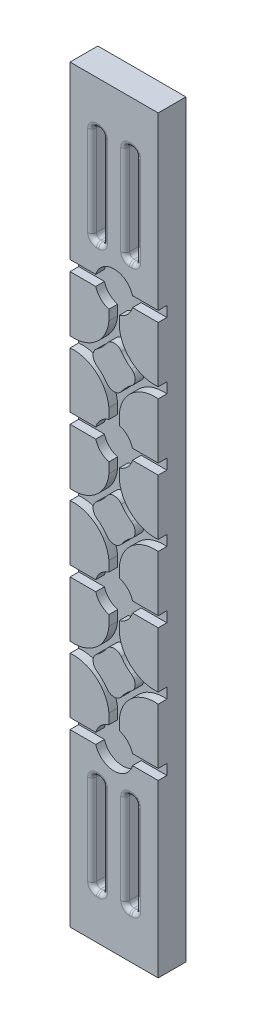
from build123d import *

# Parameters (mm, degrees)
SKETCH1_W           = 25.4
SKETCH1_H           = 215.9
SKETCH1_W_2         = 3.175
SKETCH1_H_2         = 28.575
BOSS_EXTRUDE1_DEPTH = 8
FILLET1_R           = 1.27
CUT_EXTRUDE1_DEPTH  = 2.5
FILLET2_R           = 2.54


with BuildPart() as part:
    # Sketch1 → Boss-Extrude1 (new body)
    with BuildSketch(Plane.XY):
        with Locations((12.7, 107.95)):
            Rectangle(SKETCH1_W, SKETCH1_H)
        with Locations((7.9375, 188.9125)):
            Rectangle(SKETCH1_W_2, SKETCH1_H_2, mode=Mode.SUBTRACT)
        with Locations((17.4625, 188.9125)):
            Rectangle(SKETCH1_W_2, SKETCH1_H_2, mode=Mode.SUBTRACT)
        with Locations((7.9375, 26.9875)):
            Rectangle(SKETCH1_W_2, SKETCH1_H_2, mode=Mode.SUBTRACT)
        with Locations((17.4625, 26.9875)):
            Rectangle(SKETCH1_W_2, SKETCH1_H_2, mode=Mode.SUBTRACT)
    extrude(amount=BOSS_EXTRUDE1_DEPTH)

    # Fillet1
    fillet1_edges = [part.edges().sort_by_distance(p)[0] for p in [
        (6.35, 188.9125, 0),
        (6.35, 203.2, 4),
        (7.9375, 174.625, 0),
        (6.35, 174.625, 4),
        (9.525, 188.9125, 0),
        (9.525, 174.625, 4),
        (7.9375, 203.2, 0),
        (9.525, 203.2, 4),
        (6.35, 188.9125, 8),
        (7.9375, 174.625, 8),
        (9.525, 188.9125, 8),
        (7.9375, 203.2, 8),
        (15.875, 188.9125, 0),
        (15.875, 203.2, 4),
        (17.4625, 174.625, 0),
        (15.875, 174.625, 4),
        (19.05, 188.9125, 0),
        (19.05, 174.625, 4),
        (17.4625, 203.2, 0),
        (19.05, 203.2, 4),
        (15.875, 188.9125, 8),
        (17.4625, 174.625, 8),
        (19.05, 188.9125, 8),
        (17.4625, 203.2, 8),
        (15.875, 26.9875, 0),
        (15.875, 41.275, 4),
        (17.4625, 12.7, 0),
        (15.875, 12.7, 4),
        (19.05, 26.9875, 0),
        (19.05, 12.7, 4),
        (17.4625, 41.275, 0),
        (19.05, 41.275, 4),
        (15.875, 26.9875, 8),
        (17.4625, 12.7, 8),
        (19.05, 26.9875, 8),
        (17.4625, 41.275, 8),
        (6.35, 26.9875, 0),
        (6.35, 41.275, 4),
        (7.9375, 12.7, 0),
        (6.35, 12.7, 4),
        (9.525, 26.9875, 0),
        (9.525, 12.7, 4),
        (7.9375, 41.275, 0),
        (9.525, 41.275, 4),
        (6.35, 26.9875, 8),
        (7.9375, 12.7, 8),
        (9.525, 26.9875, 8),
        (7.9375, 41.275, 8),
    ]]
    fillet(fillet1_edges, radius=FILLET1_R)

    # Sketch2 → Cut-Extrude1 (cut)
    with BuildSketch(Plane.XY.offset(8)):
        with BuildLine():
            Line((17.991502622, 166.6), (25.4, 166.6))
            Line((25.4, 166.6), (25.4, 163.6))
            Line((25.4, 163.6), (17.991502622, 163.6))
            ThreePointArc((17.991502622, 163.6), (16.589087297, 161.210912703), (14.2, 159.808497378))
            Line((14.2, 159.808497378), (14.2, 156.872584634))
            ThreePointArc((14.2, 156.872584634), (17.861892929, 149.884354278), (25.4, 147.555885873))
            Line((25.4, 147.555885873), (27.4, 147.555885873))
            Line((27.4, 147.555885873), (27.4, 144.544114127))
            Line((27.4, 144.544114127), (25.4, 144.544114127))
            ThreePointArc((25.4, 144.544114127), (17.86189371, 142.215646372), (14.200000179, 135.227417389))
            Line((14.200000179, 135.227417389), (14.2, 132.291502622))
            ThreePointArc((14.2, 132.291502622), (16.589087297, 130.889087297), (17.991502622, 128.5))
            Line((17.991502622, 128.5), (25.4, 128.5))
            Line((25.4, 128.5), (25.4, 125.5))
            Line((25.4, 125.5), (17.991502622, 125.5))
            ThreePointArc((17.991502622, 125.5), (16.589087297, 123.110912703), (14.2, 121.708497378))
            Line((14.2, 121.708497378), (14.2, 118.772584634))
            ThreePointArc((14.2, 118.772584634), (17.861892929, 111.784354278), (25.4, 109.455885873))
            Line((25.4, 109.455885873), (27.4, 109.455885873))
            Line((27.4, 109.455885873), (27.4, 106.444114127))
            Line((27.4, 106.444114127), (25.4, 106.444114127))
            ThreePointArc((25.4, 106.444114127), (17.86189371, 104.115646372), (14.200000179, 97.127417389))
            Line((14.200000179, 97.127417389), (14.2, 94.191502622))
            ThreePointArc((14.2, 94.191502622), (16.589087297, 92.789087297), (17.991502622, 90.4))
            Line((17.991502622, 90.4), (25.4, 90.4))
            Line((25.4, 90.4), (25.4, 87.4))
            Line((25.4, 87.4), (17.991502622, 87.4))
            ThreePointArc((17.991502622, 87.4), (16.589087297, 85.010912703), (14.2, 83.608497378))
            Line((14.2, 83.608497378), (14.2, 80.672584634))
            ThreePointArc((14.2, 80.672584634), (17.861892929, 73.684354278), (25.4, 71.355885873))
            Line((25.4, 71.355885873), (27.4, 71.355885873))
            Line((27.4, 71.355885873), (27.4, 68.344114127))
            Line((27.4, 68.344114127), (25.4, 68.344114127))
            ThreePointArc((25.4, 68.344114127), (17.86189371, 66.015646372), (14.200000179, 59.027417389))
            Line((14.200000179, 59.027417389), (14.2, 56.091502622))
            ThreePointArc((14.2, 56.091502622), (16.589087297, 54.689087297), (17.991502622, 52.3))
            Line((17.991502622, 52.3), (25.4, 52.3))
            Line((25.4, 52.3), (25.4, 49.3))
            Line((25.4, 49.3), (17.991502622, 49.3))
            ThreePointArc((17.991502622, 49.3), (12.7, 45.3), (7.408497378, 49.3))
            Line((7.408497378, 49.3), (0, 49.3))
            Line((0, 49.3), (0, 52.3))
            Line((0, 52.3), (7.408497378, 52.3))
            ThreePointArc((7.408497378, 52.3), (8.810912703, 54.689087297), (11.2, 56.091502622))
            Line((11.2, 56.091502622), (11.199999821, 59.027417389))
            ThreePointArc((11.199999821, 59.027417389), (7.53810629, 66.015646372), (0, 68.344114127))
            Line((0, 68.344114127), (-2, 68.344114127))
            Line((-2, 68.344114127), (-2, 71.355885873))
            Line((-2, 71.355885873), (0, 71.355885873))
            ThreePointArc((0, 71.355885873), (7.538107071, 73.684354278), (11.2, 80.672584634))
            Line((11.2, 80.672584634), (11.2, 83.608497378))
            ThreePointArc((11.2, 83.608497378), (8.810912703, 85.010912703), (7.408497378, 87.4))
            Line((7.408497378, 87.4), (0, 87.4))
            Line((0, 87.4), (0, 90.4))
            Line((0, 90.4), (7.408497378, 90.4))
            ThreePointArc((7.408497378, 90.4), (8.810912703, 92.789087297), (11.2, 94.191502622))
            Line((11.2, 94.191502622), (11.199999821, 97.127417389))
            ThreePointArc((11.199999821, 97.127417389), (7.53810629, 104.115646372), (0, 106.444114127))
            Line((0, 106.444114127), (-2, 106.444114127))
            Line((-2, 106.444114127), (-2, 109.455885873))
            Line((-2, 109.455885873), (0, 109.455885873))
            ThreePointArc((0, 109.455885873), (7.538107071, 111.784354278), (11.2, 118.772584634))
            Line((11.2, 118.772584634), (11.2, 121.708497378))
            ThreePointArc((11.2, 121.708497378), (8.810912703, 123.110912703), (7.408497378, 125.5))
            Line((7.408497378, 125.5), (0, 125.5))
            Line((0, 125.5), (0, 128.5))
            Line((0, 128.5), (7.408497378, 128.5))
            ThreePointArc((7.408497378, 128.5), (8.810912703, 130.889087297), (11.2, 132.291502622))
            Line((11.2, 132.291502622), (11.199999821, 135.227417389))
            ThreePointArc((11.199999821, 135.227417389), (7.53810629, 142.215646372), (0, 144.544114127))
            Line((0, 144.544114127), (-2, 144.544114127))
            Line((-2, 144.544114127), (-2, 147.555885873))
            Line((-2, 147.555885873), (0, 147.555885873))
            ThreePointArc((0, 147.555885873), (7.538107071, 149.884354278), (11.2, 156.872584634))
            Line((11.2, 156.872584634), (11.2, 159.808497378))
            ThreePointArc((11.2, 159.808497378), (8.810912703, 161.210912703), (7.408497378, 163.6))
            Line((7.408497378, 163.6), (0, 163.6))
            Line((0, 163.6), (0, 166.6))
            Line((0, 166.6), (7.408497378, 166.6))
            ThreePointArc((7.408497378, 166.6), (12.7, 170.6), (17.991502622, 166.6))
        make_face()
        with BuildLine():
            ThreePointArc((23.45854106, 146.05), (16.107075331, 149.457049424), (12.7, 156.808503145))
            ThreePointArc((12.7, 156.808503145), (9.292924669, 149.457049424), (1.94145894, 146.05))
            ThreePointArc((1.94145894, 146.05), (9.292924669, 142.642950576), (12.7, 135.291496855))
            ThreePointArc((12.7, 135.291496855), (16.107075331, 142.642950576), (23.45854106, 146.05))
        make_face(mode=Mode.SUBTRACT)
        with BuildLine():
            ThreePointArc((23.45854106, 107.95), (16.107075331, 111.357049424), (12.7, 118.708503145))
            ThreePointArc((12.7, 118.708503145), (9.292924669, 111.357049424), (1.94145894, 107.95))
            ThreePointArc((1.94145894, 107.95), (9.292924669, 104.542950576), (12.7, 97.191496855))
            ThreePointArc((12.7, 97.191496855), (16.107075331, 104.542950576), (23.45854106, 107.95))
        make_face(mode=Mode.SUBTRACT)
        with BuildLine():
            ThreePointArc((23.45854106, 69.85), (16.107075331, 73.257049424), (12.7, 80.608503145))
            ThreePointArc((12.7, 80.608503145), (9.292924669, 73.257049424), (1.94145894, 69.85))
            ThreePointArc((1.94145894, 69.85), (9.292924669, 66.442950576), (12.7, 59.091496855))
            ThreePointArc((12.7, 59.091496855), (16.107075331, 66.442950576), (23.45854106, 69.85))
        make_face(mode=Mode.SUBTRACT)
    extrude(amount=-CUT_EXTRUDE1_DEPTH, mode=Mode.SUBTRACT)

    # Fillet2
    fillet2_edges = [part.edges().sort_by_distance(p)[0] for p in [
        (1.94145894, 146.05, 6.75),
        (12.7, 156.808503145, 6.75),
        (23.45854106, 146.05, 6.75),
        (12.7, 135.291496855, 6.75),
        (1.94145894, 107.95, 6.75),
        (12.7, 118.708503145, 6.75),
        (23.45854106, 107.95, 6.75),
        (12.7, 97.191496855, 6.75),
        (1.94145894, 69.85, 6.75),
        (12.7, 80.608503145, 6.75),
        (23.45854106, 69.85, 6.75),
        (12.7, 59.091496855, 6.75),
    ]]
    fillet(fillet2_edges, radius=FILLET2_R)


solid = part.part
